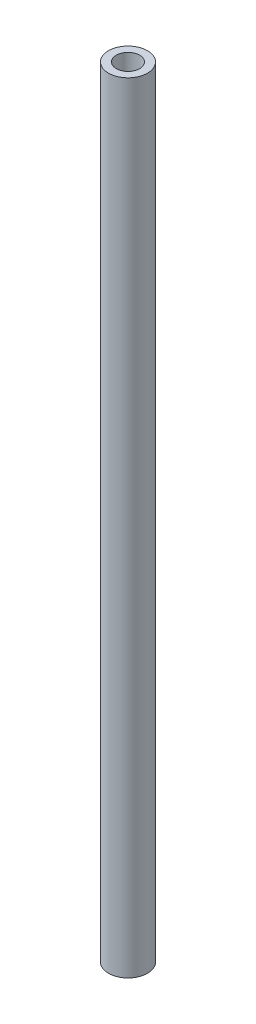
from build123d import *

# Parameters (mm, degrees)
SKETCH_1_R      = 2.5
SKETCH_1_R_2    = 1.5
EXTRUDE_1_DEPTH = 100


with BuildPart() as part:
    # 草图1 → 凸台-拉伸1 (new body)
    with BuildSketch(Plane(origin=(0, 0, 0), x_dir=(1, 0, 0), z_dir=(0, 1, 0))):
        with Locations(Location((0, 0, 0), (0, 0, 270))):
            Circle(SKETCH_1_R)
        with Locations(Location((0, 0, 0), (0, 0, 270))):
            Circle(SKETCH_1_R_2, mode=Mode.SUBTRACT)
    extrude(amount=EXTRUDE_1_DEPTH)


solid = part.part
